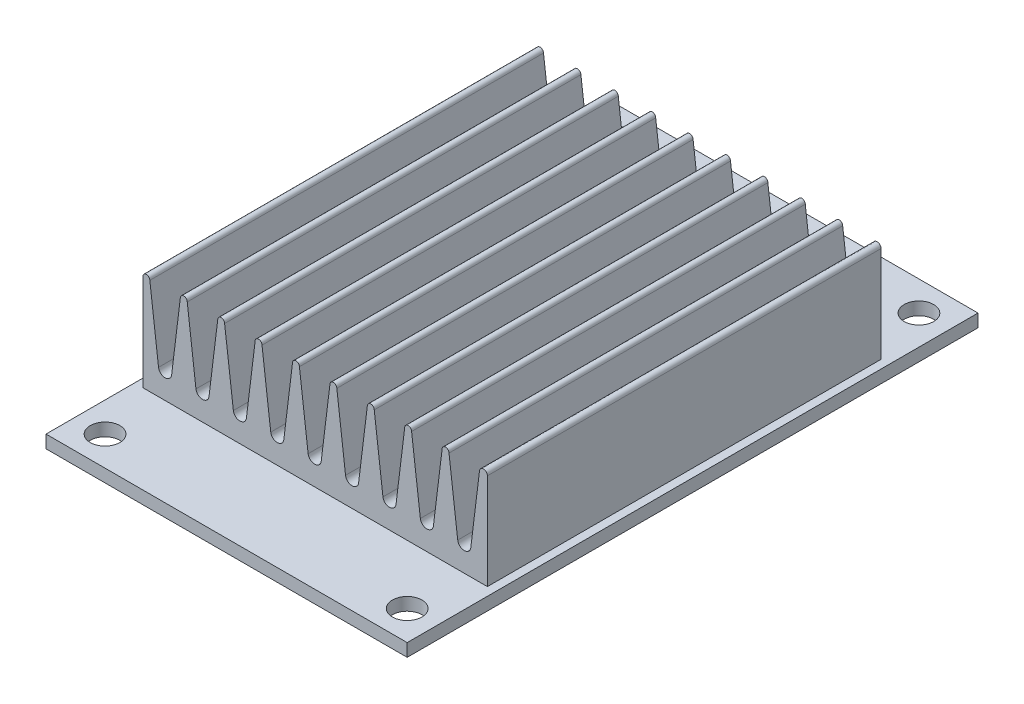
from build123d import *

# Parameters (mm, degrees)
CROQUIS1_W              = 36.7
CROQUIS1_H              = 58
CROQUIS1_R              = 1.5
SALIENTE_EXTRUIR1_DEPTH = 1.3
CROQUIS2_W              = 35
CROQUIS2_H              = 40
SALIENTE_EXTRUIR2_DEPTH = 10.2
CORTAR_EXTRUIR1_DEPTH   = 54.572124281


with BuildPart() as part:
    # Croquis1 → Saliente-Extruir1 (new body)
    with BuildSketch(Plane(origin=(0, 0, 0), x_dir=(1, 0, 0), z_dir=(0, 1, 0))):
        Rectangle(CROQUIS1_W, CROQUIS1_H)
        with Locations(Location((15.35, 26, 0), (0, 0, 270))):
            Circle(CROQUIS1_R, mode=Mode.SUBTRACT)
        with Locations(Location((-15.35, 26, 0), (0, 0, 270))):
            Circle(CROQUIS1_R, mode=Mode.SUBTRACT)
        with Locations(Location((-15.35, -26, 0), (0, 0, 270))):
            Circle(CROQUIS1_R, mode=Mode.SUBTRACT)
        with Locations(Location((15.35, -26, 0), (0, 0, 270))):
            Circle(CROQUIS1_R, mode=Mode.SUBTRACT)
    extrude(amount=SALIENTE_EXTRUIR1_DEPTH)

    # Croquis2 → Saliente-Extruir2 (add)
    with BuildSketch(Plane(origin=(0, 1.3, 0), x_dir=(1, 0, 0), z_dir=(0, 1, 0))):
        Rectangle(CROQUIS2_W, CROQUIS2_H)
    extrude(amount=SALIENTE_EXTRUIR2_DEPTH)

    # Croquis3 → Cortar-Extruir1 (cut, through all)
    with BuildSketch(Plane.XY.offset(20)):
        with BuildLine():
            Line((-16.8, 11.1), (-15.914461251, 3.887865656))
            ThreePointArc((-15.914461251, 3.887865656), (-15.25, 3.3), (-14.585538749, 3.887865656))
            Line((-14.585538749, 3.887865656), (-13.7, 11.1))
            ThreePointArc((-13.7, 11.1), (-13.35, 11.45), (-13, 11.1))
            Line((-13, 11.1), (-12.114461251, 3.887865656))
            ThreePointArc((-12.114461251, 3.887865656), (-11.45, 3.3), (-10.785538749, 3.887865656))
            Line((-10.785538749, 3.887865656), (-9.9, 11.1))
            ThreePointArc((-9.9, 11.1), (-9.55, 11.45), (-9.2, 11.1))
            Line((-9.2, 11.1), (-8.314461251, 3.887865656))
            ThreePointArc((-8.314461251, 3.887865656), (-7.65, 3.3), (-6.985538749, 3.887865656))
            Line((-6.985538749, 3.887865656), (-6.1, 11.1))
            ThreePointArc((-6.1, 11.1), (-5.75, 11.45), (-5.4, 11.1))
            Line((-5.4, 11.1), (-4.514461251, 3.887865656))
            ThreePointArc((-4.514461251, 3.887865656), (-3.85, 3.3), (-3.185538749, 3.887865656))
            Line((-3.185538749, 3.887865656), (-2.3, 11.1))
            ThreePointArc((-2.3, 11.1), (-1.95, 11.45), (-1.6, 11.1))
            Line((-1.6, 11.1), (-0.714461251, 3.887865656))
            ThreePointArc((-0.714461251, 3.887865656), (-0.05, 3.3), (0.614461251, 3.887865656))
            Line((0.614461251, 3.887865656), (1.5, 11.1))
            ThreePointArc((1.5, 11.1), (1.85, 11.45), (2.2, 11.1))
            Line((2.2, 11.1), (3.085538749, 3.887865656))
            ThreePointArc((3.085538749, 3.887865656), (3.75, 3.3), (4.414461251, 3.887865656))
            Line((4.414461251, 3.887865656), (5.3, 11.1))
            ThreePointArc((5.3, 11.1), (5.65, 11.45), (6, 11.1))
            Line((6, 11.1), (6.885538749, 3.887865656))
            ThreePointArc((6.885538749, 3.887865656), (7.55, 3.3), (8.214461251, 3.887865656))
            Line((8.214461251, 3.887865656), (9.1, 11.1))
            ThreePointArc((9.1, 11.1), (9.45, 11.45), (9.8, 11.1))
            Line((9.8, 11.1), (10.685538749, 3.887865656))
            ThreePointArc((10.685538749, 3.887865656), (11.35, 3.3), (12.014461251, 3.887865656))
            Line((12.014461251, 3.887865656), (12.9, 11.1))
            ThreePointArc((12.9, 11.1), (13.25, 11.45), (13.6, 11.1))
            Line((13.6, 11.1), (14.485538749, 3.887865656))
            ThreePointArc((14.485538749, 3.887865656), (15.15, 3.3), (15.814461251, 3.887865656))
            Line((15.814461251, 3.887865656), (16.7, 11.1))
            ThreePointArc((16.7, 11.1), (17.123486281, 11.450780489), (17.5, 11.05))
            Line((17.5, 11.05), (17.5, 11.5))
            Line((17.5, 11.5), (-17.5, 11.5))
            Line((-17.5, 11.5), (-17.5, 11.1))
            ThreePointArc((-17.5, 11.1), (-17.15, 11.45), (-16.8, 11.1))
        make_face()
    extrude(amount=-CORTAR_EXTRUIR1_DEPTH, mode=Mode.SUBTRACT)


solid = part.part
